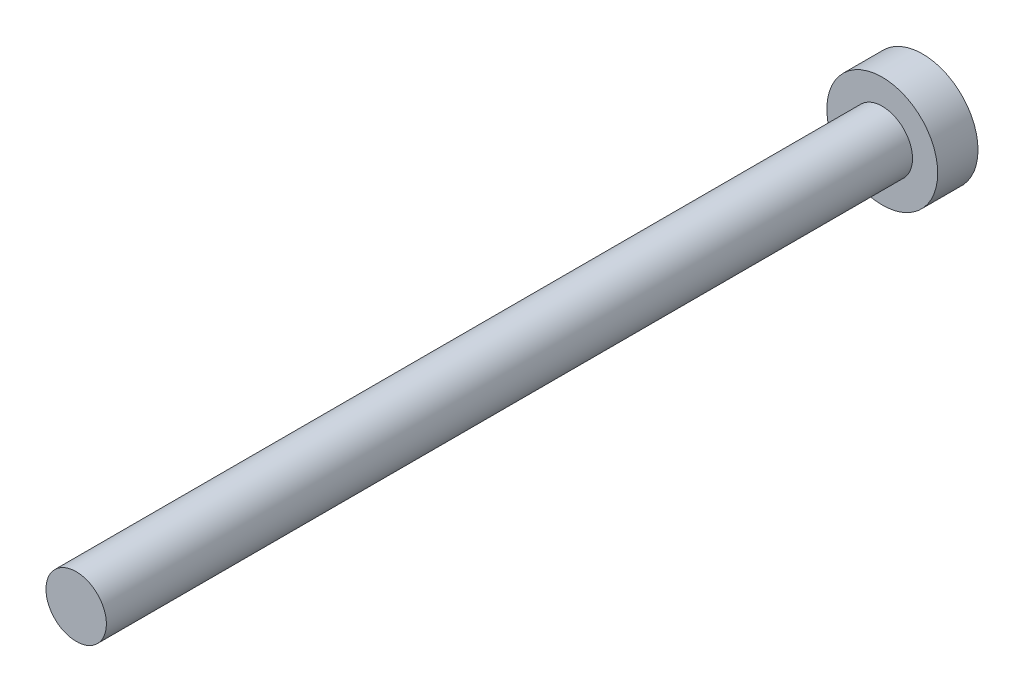
from build123d import *

# Parameters (mm, degrees)
SKETCH_1_R       = 1.5
M3X40_DEPTH      = 40
EXTRUDE_START    = -2
SKETCH_2_R       = 2.75
EXTRUDE_M3_DEPTH = 2


with BuildPart() as part:
    # 草图1 → M3x40螺杆简化 (new body)
    with BuildSketch(Plane.XY):
        Circle(SKETCH_1_R)
    extrude(amount=M3X40_DEPTH)

    # 草图2 → M3螺钉头简化 (add)
    with BuildSketch(Plane.XY.offset(EXTRUDE_START)):
        Circle(SKETCH_2_R)
    extrude(amount=EXTRUDE_M3_DEPTH)


solid = part.part
